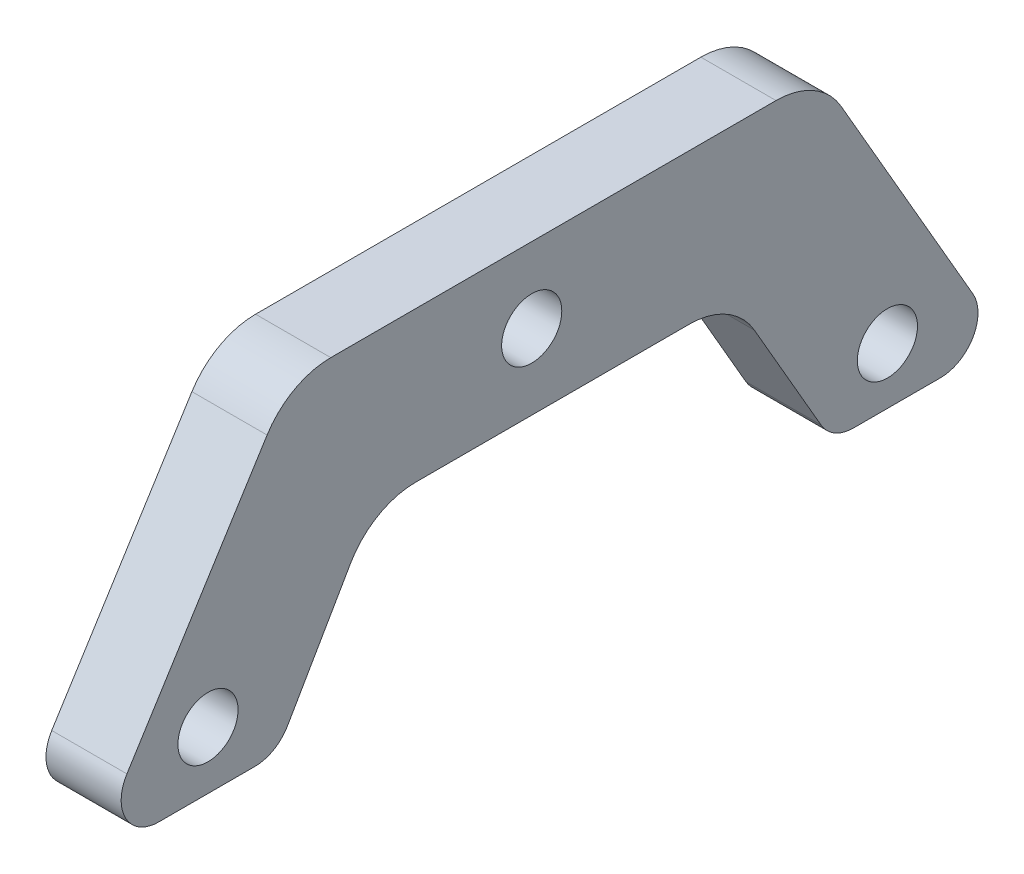
from build123d import *

# Parameters (mm, degrees)
SKETCH1_R           = 8
BOSS_EXTRUDE1_DEPTH = 20


with BuildPart() as part:
    # Sketch1 → Boss-Extrude1 (new body)
    with BuildSketch(Plane(origin=(0, 0, 0), x_dir=(0, 0, -1), z_dir=(1, 0, 0))):
        with BuildLine():
            Line((-139.248116041, 30.619697735), (-101.955216425, 90.044413341))
            ThreePointArc((-101.955216425, 90.044413341), (-94.694061218, 96.914975381), (-85.014811773, 99.413200323))
            Line((-85.014811773, 99.413200323), (33.441717862, 99.413200323))
            ThreePointArc((33.441717862, 99.413200323), (43.441717862, 96.733708398), (50.762225937, 89.413200323))
            Line((50.762225937, 89.413200323), (85.840913151, 28.655131806))
            ThreePointArc((85.840913151, 28.655131806), (85.840913151, 18.655131806), (77.180659113, 13.655131806))
            Line((77.180659113, 13.655131806), (54.086648345, 13.655131806))
            ThreePointArc((54.086648345, 13.655131806), (49.086648345, 14.994877768), (45.426394308, 18.655131806))
            Line((45.426394308, 18.655131806), (27.66821517, 49.413200323))
            ThreePointArc((27.66821517, 49.413200323), (20.347707094, 56.733708398), (10.347707094, 59.413200323))
            Line((10.347707094, 59.413200323), (-62.406928949, 59.413200323))
            ThreePointArc((-62.406928949, 59.413200323), (-72.406928949, 56.733708398), (-79.727437025, 49.413200323))
            Line((-79.727437025, 49.413200323), (-96.533588998, 20.304091226))
            ThreePointArc((-96.533588998, 20.304091226), (-100.193843035, 16.643837188), (-105.193843035, 15.304091226))
            Line((-105.193843035, 15.304091226), (-130.777913715, 15.304091226))
            ThreePointArc((-130.777913715, 15.304091226), (-139.528801244, 20.464466504), (-139.248116041, 30.619697735))
        make_face()
        with Locations((-31.553843665, 79.413200323)):
            Circle(SKETCH1_R, mode=Mode.SUBTRACT)
        with Locations((-117.681607113, 30.619697735)):
            Circle(SKETCH1_R, mode=Mode.SUBTRACT)
        with Locations((63.073370123, 28.655131806)):
            Circle(SKETCH1_R, mode=Mode.SUBTRACT)
    extrude(amount=BOSS_EXTRUDE1_DEPTH)


solid = part.part
